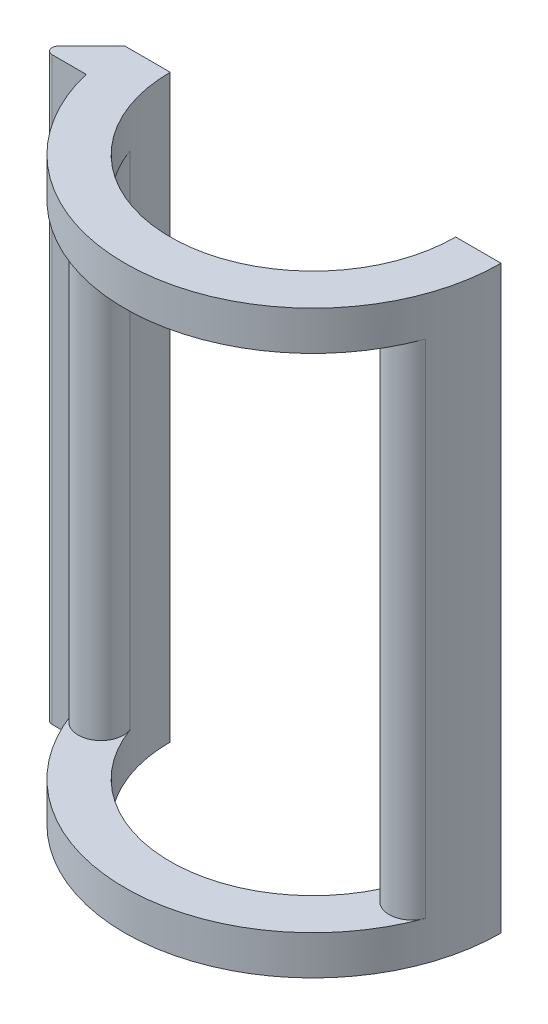
from build123d import *

# Parameters (mm, degrees)
BOSS_EXTRUDE1_DEPTH = 117.475
FILLET2_R           = 1.27
CUT_EXTRUDE2_START  = 7.9375
CUT_EXTRUDE2_DEPTH  = 101.6


with BuildPart() as part:
    # Sketch4 → Boss-Extrude1 (new body)
    with BuildSketch(Plane(origin=(0, 0, 0), x_dir=(1, 0, 0), z_dir=(0, 1, 0))):
        with BuildLine():
            Line((-28.9052, 0), (-38.1, 0))
            Line((-38.1, 0), (-46.99, -8.89))
            Line((-46.99, -8.89), (-38.1, -8.89))
            Line((-38.1, -8.89), (-37.04831845, -8.89))
            ThreePointArc((-37.04831845, -8.89), (4.475995255, -37.836166118), (38.1, 0))
            Line((38.1, 0), (28.9052, 0))
            ThreePointArc((28.9052, 0), (0, -28.9052), (-28.9052, 0))
        make_face()
    extrude(amount=BOSS_EXTRUDE1_DEPTH)

    # Fillet2
    fillet2_edges = [part.edges().sort_by_distance(p)[0] for p in [
        (-46.99, 58.7375, 8.89),
    ]]
    fillet(fillet2_edges, radius=FILLET2_R)

    # Sketch6 → Cut-Extrude2 (cut)
    with BuildSketch(Plane(origin=(0, 0, 0), x_dir=(1, 0, 0), z_dir=(0, 1, 0)).offset(CUT_EXTRUDE2_START)):
        with BuildLine():
            ThreePointArc((-35.802288852, -13.030967461), (0, -38.1), (35.802288852, -13.030967461))
            ThreePointArc((35.802288852, -13.030967461), (29.90974259, -15.778706909), (27.162003142, -9.886160647))
            ThreePointArc((27.162003142, -9.886160647), (0, -28.9052), (-27.162003142, -9.886160647))
            ThreePointArc((-27.162003142, -9.886160647), (-29.90974259, -15.778706909), (-35.802288852, -13.030967461))
        make_face()
    extrude(amount=CUT_EXTRUDE2_DEPTH, mode=Mode.SUBTRACT)


solid = part.part
